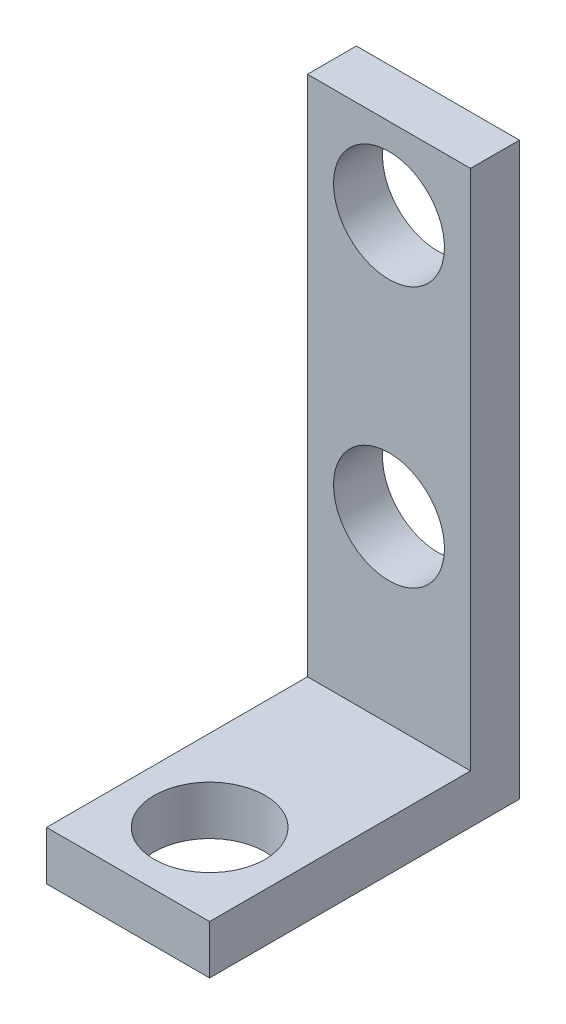
from build123d import *

# Parameters (mm, degrees)
BOSS_EXTRUDE1_DEPTH = 5
SKETCH2_R           = 1.7
CUT_EXTRUDE1_DEPTH  = 19.809904306
SKETCH3_R           = 1.7
CUT_EXTRUDE2_DEPTH  = 14.849638984


with BuildPart() as part:
    # Sketch1 → Boss-Extrude1 (new body)
    with BuildSketch(Plane(origin=(0, 0, 0), x_dir=(0, 0, -1), z_dir=(1, 0, 0))):
        Polygon((-4.75, -7.25), (-4.75, -8.75), (4.75, -8.75), (4.75, 8.75), (3.25, 8.75), (3.25, -7.25), align=None)
    extrude(amount=BOSS_EXTRUDE1_DEPTH)

    # Sketch2 → Cut-Extrude1 (cut, through all)
    with BuildSketch(Plane.XZ.offset(8.75)):
        with Locations(Location((2.5, 2.25, 0), (0, 0, 270))):
            Circle(SKETCH2_R)
    extrude(amount=-CUT_EXTRUDE1_DEPTH, mode=Mode.SUBTRACT)

    # Sketch3 → Cut-Extrude2 (cut, through all)
    with BuildSketch(Plane(origin=(0, 0, -4.75), x_dir=(-1, 0, 0), z_dir=(0, 0, -1))):
        with Locations((-2.5, -1.75)):
            Circle(SKETCH3_R)
        with Locations((-2.5, 6.25)):
            Circle(SKETCH3_R)
    extrude(amount=-CUT_EXTRUDE2_DEPTH, mode=Mode.SUBTRACT)


solid = part.part
